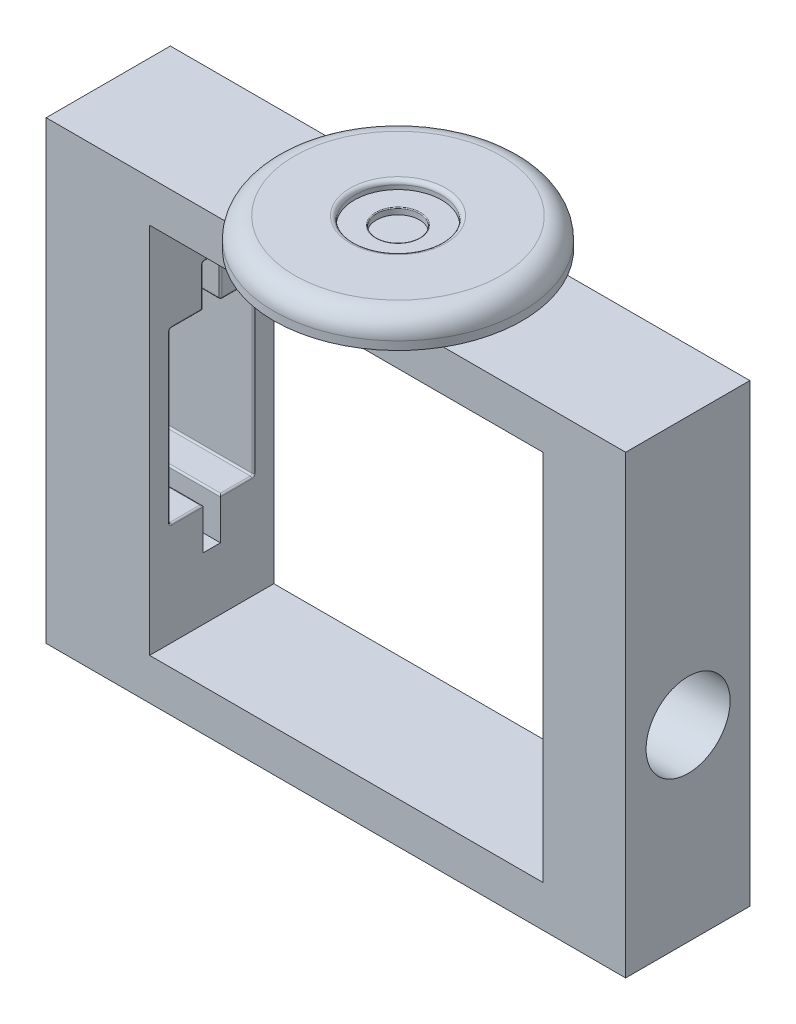
from build123d import *

# Parameters (mm, degrees)
FILLET1_R           = 1
SKETCH2_R           = 5.2
CUT_EXTRUDE1_DEPTH  = 1.5
FILLET2_R           = 0.2
FILLET3_R           = 5
CUT_EXTRUDE2_DEPTH  = 1
SKETCH14_W          = 140
SKETCH14_H          = 30
BOSS_EXTRUDE1_DEPTH = 10
SKETCH15_W          = 25
SKETCH15_H          = 30
SKETCH15_W_2        = 20
BOSS_EXTRUDE2_DEPTH = 90
SKETCH16_W          = 140
SKETCH16_H          = 30
BOSS_EXTRUDE3_DEPTH = 10
SKETCH17_W          = 20.2
SKETCH17_H          = 40.8
CUT_EXTRUDE3_DEPTH  = 25
SKETCH19_W          = 25
SKETCH19_H          = 4.2
CUT_EXTRUDE4_DEPTH  = 10
SKETCH21_W          = 25
SKETCH21_H          = 4.2
CUT_EXTRUDE6_DEPTH  = 10
FILLET4_R           = 0.4
SKETCH22_R          = 10.15
CUT_EXTRUDE7_DEPTH  = 22


with BuildPart() as part:
    # Sketch1 → Revolve1 (revolve)
    with BuildSketch(Plane(origin=(0, 0, 0), x_dir=(0, 0, -1), z_dir=(1, 0, 0))):
        Polygon((0, 0), (-30, 0), (-30, 7), (-20.102542457, 7), (-10.55, 7), (-10.55, 5), (0, 5), align=None)
    revolve(axis=Axis((0, 5, 0), (0, -1, 0)))

    # Fillet1
    fillet1_edges = [part.edges().sort_by_distance(p)[0] for p in [
        (0, 7, -10.55),
    ]]
    fillet(fillet1_edges, radius=FILLET1_R)

    # Sketch2 → Cut-Extrude1 (cut)
    with BuildSketch(Plane(origin=(0, 5, 0), x_dir=(1, 0, 0), z_dir=(0, 1, 0))):
        with Locations(Location((0, 0, 0), (0, 0, 270))):
            Circle(SKETCH2_R)
    extrude(amount=-CUT_EXTRUDE1_DEPTH, mode=Mode.SUBTRACT)

    # Fillet2
    fillet2_edges = [part.edges().sort_by_distance(p)[0] for p in [
        (0, 5, -5.2),
    ]]
    fillet(fillet2_edges, radius=FILLET2_R)

    # Fillet3
    fillet3_edges = [part.edges().sort_by_distance(p)[0] for p in [
        (0, 7, -30),
    ]]
    fillet(fillet3_edges, radius=FILLET3_R)

    # Sketch4 → Cut-Extrude2 (cut)
    # profile 1 of 4: a face of its own
    with BuildSketch(Plane.XZ):
        Polygon((-0.644909543, 25.480704332), (0.002225874, 25.480704332), (0.002225874, 21.980704332), (-0.31187669, 21.980704332), (-0.31187669, 25.121729973), (-0.850338229, 25.121729973), align=None)
    # profile 2 of 4: a face of its own
    with BuildSketch(Plane.XZ):
        with BuildLine():
            Line((25.523815675, 2.292498481), (25.209713111, 2.292498481))
            add(Edge.make_bspline(
                [(25.209713111, 2.292498481), (25.211760264, 2.334169369), (25.215780818, 2.416009884), (25.234609107, 2.53533379), (25.261549984, 2.649388589), (25.299641438, 2.757258503), (25.346947716, 2.85989731), (25.403677743, 2.956897326), (25.470871594, 3.047888515), (25.547078328, 3.132027358), (25.629846967, 3.209214929), (25.719152906, 3.275870171), (25.812997934, 3.332187843), (25.911097333, 3.379269085), (26.014557896, 3.414608931), (26.122440754, 3.44083057), (26.23521989, 3.456606916), (26.312059912, 3.458302702), (26.351139393, 3.459165148)],
                knots=[0, 0, 0, 0, 1.10065271, 2.161652631, 3.183658789, 4.190468796, 5.17591951, 6.163126047, 7.15150782, 8.156236427, 9.156009102, 10.134482811, 11.092018607, 12.041330605, 13.001268258, 13.972401359, 14.968799086, 16, 16, 16, 16], degree=3))
            add(Edge.make_bspline(
                [(26.351139393, 3.459165148), (26.389517467, 3.458266692), (26.464929011, 3.456501257), (26.574991026, 3.441340228), (26.67976832, 3.417594636), (26.779056087, 3.38427922), (26.872062151, 3.339494792), (26.959485196, 3.285697254), (27.042366007, 3.223477422), (27.11697279, 3.150223609), (27.18548087, 3.072021224), (27.244583125, 2.988533321), (27.295196288, 2.902304035), (27.337383968, 2.812675833), (27.368440107, 2.718804805), (27.392018315, 2.622057602), (27.405345729, 2.521432791), (27.407391152, 2.453326236), (27.408431059, 2.418700405)],
                knots=[0, 0, 0, 0, 1.111607364, 2.184268762, 3.212621178, 4.221274766, 5.211760367, 6.196651075, 7.1921475, 8.207485113, 9.220403448, 10.201281604, 11.166441695, 12.114753415, 13.065576456, 14.026450734, 14.996634279, 16, 16, 16, 16], degree=3))
            add(Edge.make_bspline(
                [(27.408431059, 2.418700405), (27.406744414, 2.369950595), (27.403400723, 2.273306467), (27.37454502, 2.13110211), (27.329962923, 1.99319705), (27.275889894, 1.882217998), (27.221269326, 1.793241105), (27.17308953, 1.719325464), (27.115437178, 1.640499047), (27.048839764, 1.555967938), (26.974301958, 1.465473568), (26.89128729, 1.368978802), (26.7991616, 1.267508497), (26.734503418, 1.198202684), (26.700999168, 1.162290148)],
                knots=[0, 0, 0, 0, 1.184203166, 2.347625244, 3.513805382, 4.700623107, 5.337941753, 6.051866363, 6.845199593, 7.711357327, 8.668078039, 9.695487809, 10.805859518, 12, 12, 12, 12], degree=3))
            Line((26.700999168, 1.162290148), (25.825298046, 0.228395917))
            Line((25.825298046, 0.228395917), (27.453302854, 0.228395917))
            Line((27.453302854, 0.228395917), (27.453302854, -0.130578442))
            Line((27.453302854, -0.130578442), (25.075097726, -0.130578442))
            Line((25.075097726, -0.130578442), (26.432469521, 1.317939187))
            add(Edge.make_bspline(
                [(26.432469521, 1.317939187), (26.465517408, 1.352437493), (26.528995635, 1.41870168), (26.618778212, 1.51544464), (26.6994172, 1.605194181), (26.771434593, 1.687780729), (26.833268098, 1.764412297), (26.88814033, 1.832607), (26.932105921, 1.895361451), (26.979821317, 1.968102065), (27.026035298, 2.056914382), (27.065747654, 2.165448071), (27.089962502, 2.277175324), (27.092867338, 2.352677361), (27.094328495, 2.390655533)],
                knots=[0, 0, 0, 0, 1.329631726, 2.553950428, 3.673215718, 4.687767853, 5.603093632, 6.413772471, 7.123043292, 7.734684054, 8.834405432, 9.900288307, 10.943827018, 12, 12, 12, 12], degree=3))
            add(Edge.make_bspline(
                [(27.094328495, 2.390655533), (27.093692753, 2.414536931), (27.092439827, 2.461602582), (27.081382129, 2.530608341), (27.064671623, 2.597173154), (27.040726365, 2.661501774), (27.009119625, 2.722947426), (26.970646245, 2.781584906), (26.926256182, 2.838273871), (26.874904912, 2.891427169), (26.818493393, 2.940108375), (26.758899143, 2.98323246), (26.695849039, 3.019271571), (26.629608917, 3.048815068), (26.560363447, 3.071990449), (26.487978702, 3.088049029), (26.412654686, 3.098131512), (26.36122119, 3.099495684), (26.335013591, 3.100190789)],
                knots=[0, 0, 0, 0, 0.991446411, 1.95395049, 2.89581595, 3.838931463, 4.798493298, 5.75982156, 6.748411868, 7.785213223, 8.824556874, 9.840280684, 10.836137867, 11.835679398, 12.848801643, 13.863922112, 14.911575587, 16, 16, 16, 16], degree=3))
            add(Edge.make_bspline(
                [(26.335013591, 3.100190789), (26.307642759, 3.099475757), (26.253890962, 3.098071552), (26.174971929, 3.088248888), (26.099686152, 3.071303047), (26.027844249, 3.048126373), (25.959324663, 3.018667824), (25.894460619, 2.981976079), (25.83339773, 2.938192586), (25.776021206, 2.88855203), (25.723157227, 2.833284429), (25.676710352, 2.771674466), (25.636126337, 2.70484705), (25.600717104, 2.6329825), (25.571961414, 2.55542872), (25.549988263, 2.472461015), (25.532601417, 2.384439633), (25.526792896, 2.323654549), (25.523815675, 2.292498481)],
                knots=[0, 0, 0, 0, 1.031018746, 2.02475058, 2.990194455, 3.934040569, 4.864654155, 5.795059489, 6.735614925, 7.690564532, 8.649604399, 9.611025574, 10.590972636, 11.591080095, 12.624614302, 13.701020113, 14.821632451, 16, 16, 16, 16], degree=3))
        make_face()
    # profile 3 of 4: a face of its own
    with BuildSketch(Plane.XZ):
        with BuildLine():
            Line((0.191598009, -25.382057247), (-0.122504556, -25.382057247))
            add(Edge.make_bspline(
                [(-0.122504556, -25.382057247), (-0.113995005, -25.346824763), (-0.097359529, -25.277948138), (-0.062661956, -25.179540878), (-0.024862701, -25.086417356), (0.020526404, -25.000321283), (0.070035158, -24.91952238), (0.12675788, -24.845853255), (0.188077602, -24.77744029), (0.255902552, -24.716727052), (0.327031213, -24.661749323), (0.402465833, -24.614874266), (0.480688727, -24.574550113), (0.56224186, -24.541329881), (0.647368031, -24.516304357), (0.735297655, -24.498147552), (0.826261155, -24.486356438), (0.888008745, -24.485205674), (0.919362432, -24.484621349)],
                knots=[0, 0, 0, 0, 1.162005537, 2.271625781, 3.343758855, 4.383309926, 5.390229558, 6.379919256, 7.361854164, 8.333198761, 9.295911338, 10.242430842, 11.177959212, 12.116337295, 13.062827104, 14.020064771, 14.994644689, 16, 16, 16, 16], degree=3))
            add(Edge.make_bspline(
                [(0.919362432, -24.484621349), (0.965045174, -24.48600058), (1.055414185, -24.488728955), (1.188177232, -24.513643392), (1.316204051, -24.553068524), (1.438093299, -24.607542251), (1.551311731, -24.674729564), (1.652047918, -24.754694301), (1.738936429, -24.845893603), (1.811830806, -24.946626167), (1.868905805, -25.054281676), (1.910992179, -25.165081833), (1.93661386, -25.278763805), (1.939934417, -25.355521084), (1.941598009, -25.393976317)],
                knots=[0, 0, 0, 0, 1.083050992, 2.142477498, 3.193116406, 4.255571735, 5.30263384, 6.308962982, 7.297363603, 8.282367274, 9.249857812, 10.179914175, 11.08814088, 12, 12, 12, 12], degree=3))
            add(Edge.make_bspline(
                [(1.941598009, -25.393976317), (1.940434418, -25.430983112), (1.93815745, -25.503399667), (1.918823745, -25.609121164), (1.886287482, -25.708762764), (1.841217719, -25.802743926), (1.782876169, -25.890468766), (1.712203472, -25.972134657), (1.628700811, -26.048103815), (1.565421872, -26.091623288), (1.532844002, -26.114028401)],
                knots=[0, 0, 0, 0, 1.024540389, 2.004866551, 2.965041327, 3.920577974, 4.882998113, 5.874504559, 6.905732034, 8, 8, 8, 8], degree=3))
            add(Edge.make_bspline(
                [(1.532844002, -26.114028401), (1.570075757, -26.132006572), (1.643842631, -26.16762653), (1.744393161, -26.237482287), (1.835671036, -26.318138635), (1.886574755, -26.381081288), (1.912150893, -26.412706285)],
                knots=[0, 0, 0, 0, 1.015518401, 2.012035669, 3.001164323, 4, 4, 4, 4], degree=3))
            add(Edge.make_bspline(
                [(1.912150893, -26.412706285), (1.928992236, -26.435764037), (1.962399132, -26.481501953), (2.003634665, -26.555038379), (2.04104378, -26.629389869), (2.070193999, -26.706549275), (2.092767866, -26.785622288), (2.108903898, -26.866744684), (2.118928039, -26.949982707), (2.120363591, -27.006295187), (2.121085188, -27.034601317)],
                knots=[0, 0, 0, 0, 1.025084078, 2.033381695, 3.024893161, 4.013698104, 4.991890475, 5.976764909, 6.982997093, 8, 8, 8, 8], degree=3))
            add(Edge.make_bspline(
                [(2.121085188, -27.034601317), (2.119290675, -27.083611039), (2.115710093, -27.18139984), (2.083706018, -27.325874562), (2.034092778, -27.467100064), (1.963635842, -27.602174904), (1.877768333, -27.728555285), (1.775611009, -27.841631594), (1.6583246, -27.938830198), (1.527518951, -28.020040426), (1.385801823, -28.084958348), (1.234226231, -28.130015791), (1.074976177, -28.159361791), (0.965768879, -28.16250866), (0.910247848, -28.164108529)],
                knots=[0, 0, 0, 0, 0.955779014, 1.907060117, 2.875433937, 3.871313158, 4.872415639, 5.851225146, 6.836215519, 7.83643374, 8.849228613, 9.86973379, 10.916971861, 12, 12, 12, 12], degree=3))
            add(Edge.make_bspline(
                [(0.910247848, -28.164108529), (0.872828548, -28.163240316), (0.799199843, -28.161531961), (0.690956345, -28.14985336), (0.587634645, -28.128523355), (0.489095047, -28.09982005), (0.395250011, -28.063428308), (0.306385906, -28.01810961), (0.221956012, -27.964798108), (0.142757061, -27.90286452), (0.068798493, -27.83358318), (0.002045769, -27.75572417), (-0.058614024, -27.670726766), (-0.111556662, -27.57760371), (-0.159193615, -27.477558453), (-0.198374572, -27.369309954), (-0.23286014, -27.253825932), (-0.248893605, -27.173348192), (-0.25711994, -27.132057247)],
                knots=[0, 0, 0, 0, 1.048658725, 2.063410685, 3.046034179, 4.001477787, 4.936774919, 5.862367409, 6.792675028, 7.730719943, 8.675894397, 9.627829632, 10.600096036, 11.597688215, 12.626045268, 13.701542398, 14.82072376, 16, 16, 16, 16], degree=3))
            Line((-0.25711994, -27.132057247), (0.056982624, -27.132057247))
            add(Edge.make_bspline(
                [(0.056982624, -27.132057247), (0.065165915, -27.15900626), (0.081083128, -27.211424432), (0.108177426, -27.286864737), (0.139045698, -27.356022791), (0.172160257, -27.419405913), (0.206938703, -27.477638315), (0.245853628, -27.529180184), (0.286022773, -27.576295386), (0.316302126, -27.602839998), (0.331121246, -27.615831285)],
                knots=[0, 0, 0, 0, 1.198163088, 2.33053128, 3.407730985, 4.417276592, 5.372219308, 6.28897303, 7.162600585, 8, 8, 8, 8], degree=3))
            add(Edge.make_bspline(
                [(0.331121246, -27.615831285), (0.350717822, -27.630939619), (0.389850485, -27.661109651), (0.453618716, -27.69961128), (0.520683602, -27.732972305), (0.592498277, -27.758456001), (0.667513047, -27.780033661), (0.746940412, -27.79415418), (0.830079629, -27.803842352), (0.886847393, -27.804697283), (0.915856823, -27.80513417)],
                knots=[0, 0, 0, 0, 0.946170439, 1.889420265, 2.845303464, 3.807233317, 4.801018734, 5.828864929, 6.890507805, 8, 8, 8, 8], degree=3))
            add(Edge.make_bspline(
                [(0.915856823, -27.80513417), (0.948610325, -27.804518265), (1.012656972, -27.803313915), (1.106111832, -27.792238208), (1.195019279, -27.776107795), (1.278392205, -27.751194812), (1.357322712, -27.720413961), (1.430704362, -27.681765555), (1.499500468, -27.636420833), (1.562829874, -27.584881675), (1.619775381, -27.52846018), (1.669914894, -27.469447109), (1.712539556, -27.408091279), (1.746923134, -27.344053158), (1.774073684, -27.277597929), (1.792556885, -27.2085391), (1.8054084, -27.137441834), (1.806455012, -27.089112865), (1.806982624, -27.064749555)],
                knots=[0, 0, 0, 0, 1.217147791, 2.380027433, 3.494444702, 4.572153297, 5.609568379, 6.639424714, 7.649109417, 8.668170816, 9.669597737, 10.625200337, 11.543417969, 12.441394052, 13.322311151, 14.205496177, 15.095365482, 16, 16, 16, 16], degree=3))
            add(Edge.make_bspline(
                [(1.806982624, -27.064749555), (1.805452322, -27.032138216), (1.802399334, -26.967077807), (1.779090755, -26.871360233), (1.74075189, -26.779136821), (1.687079379, -26.691981031), (1.62174365, -26.611205129), (1.545378744, -26.539133647), (1.457350515, -26.479663556), (1.376330646, -26.438574899), (1.30456549, -26.410537824), (1.243150105, -26.39186286), (1.174393502, -26.376049204), (1.099127153, -26.361336932), (1.016783936, -26.348815584), (0.927453498, -26.338373768), (0.831117737, -26.330018727), (0.764426571, -26.326287632), (0.730059547, -26.324364939)],
                knots=[0, 0, 0, 0, 1.07054697, 2.135767047, 3.216561865, 4.33974944, 5.486079747, 6.621378074, 7.775625952, 8.963672916, 9.598146892, 10.304877434, 11.070270905, 11.915000392, 12.823868403, 13.805723172, 14.86925407, 16, 16, 16, 16], degree=3))
            Line((0.730059547, -26.324364939), (0.730059547, -25.96539058))
            add(Edge.make_bspline(
                [(0.730059547, -25.96539058), (0.773360713, -25.964655776), (0.858177059, -25.963216476), (0.982071364, -25.945808466), (1.100544676, -25.921727838), (1.210971418, -25.884842646), (1.311620132, -25.842002349), (1.398939734, -25.792150139), (1.471706881, -25.73673539), (1.529567952, -25.674902781), (1.573097181, -25.608587733), (1.604923979, -25.539471076), (1.623724305, -25.466947015), (1.626233972, -25.417452347), (1.627495444, -25.392574074)],
                knots=[0, 0, 0, 0, 1.321986639, 2.589447074, 3.816329219, 5.01088745, 6.139805852, 7.153945165, 8.075214402, 8.924034688, 9.728124013, 10.488707548, 11.240355623, 12, 12, 12, 12], degree=3))
            add(Edge.make_bspline(
                [(1.627495444, -25.392574074), (1.627081034, -25.374296329), (1.626256583, -25.337933622), (1.615859305, -25.284808553), (1.600235264, -25.233307607), (1.578755535, -25.183649797), (1.550005336, -25.136179523), (1.515599349, -25.090492074), (1.474631249, -25.046848295), (1.427685802, -25.006167975), (1.377273997, -24.967398738), (1.322024222, -24.934485101), (1.263602347, -24.906340039), (1.201943692, -24.883130537), (1.136848162, -24.865671249), (1.068621604, -24.853135407), (0.997133921, -24.845297753), (0.948362189, -24.844169337), (0.923569162, -24.843595708)],
                knots=[0, 0, 0, 0, 0.884392785, 1.759457502, 2.611959086, 3.489218968, 4.37281399, 5.2945488, 6.255912374, 7.266815255, 8.301784654, 9.332968512, 10.37626691, 11.440494194, 12.520033166, 13.637162961, 14.798855837, 16, 16, 16, 16], degree=3))
            add(Edge.make_bspline(
                [(0.923569162, -24.843595708), (0.883717494, -24.84498707), (0.805877918, -24.847704724), (0.693663001, -24.871507737), (0.589343667, -24.909485821), (0.509605001, -24.95481884), (0.450722426, -24.999569274), (0.408645488, -25.038651661), (0.367324978, -25.082084484), (0.329479301, -25.13254286), (0.291205324, -25.18660965), (0.256360763, -25.247033331), (0.22250107, -25.312237726), (0.202098521, -25.35833336), (0.191598009, -25.382057247)],
                knots=[0, 0, 0, 0, 1.472543308, 2.876219568, 4.221790263, 5.565193594, 6.249813518, 6.953379497, 7.687249741, 8.463570142, 9.283606569, 10.136032583, 11.040678096, 12, 12, 12, 12], degree=3))
        make_face()
    # profile 4 of 4: a face of its own
    with BuildSketch(Plane.XZ):
        Polygon((-24.810460542, 5.722524802), (-24.746658459, 5.722524802), (-24.746658459, 3.299447879), (-24.342812305, 3.299447879), (-24.342812305, 2.94047352), (-24.746658459, 2.94047352), (-24.746658459, 2.132781212), (-25.060761023, 2.132781212), (-25.060761023, 2.94047352), (-26.721017433, 2.94047352), align=None)
        Polygon((-25.060761023, 3.299447879), (-25.060761023, 4.818077687), (-26.103329132, 3.299447879), align=None, mode=Mode.SUBTRACT)
    extrude(amount=-CUT_EXTRUDE2_DEPTH, mode=Mode.SUBTRACT)

    # Sketch14 → Boss-Extrude1 (add)
    with BuildSketch(Plane.XZ):
        Rectangle(SKETCH14_W, SKETCH14_H)
    extrude(amount=BOSS_EXTRUDE1_DEPTH)

    # Sketch15 → Boss-Extrude2 (add)
    with BuildSketch(Plane.XZ.offset(10)):
        with Locations((-57.5, 0)):
            Rectangle(SKETCH15_W, SKETCH15_H)
        with Locations((60, 0)):
            Rectangle(SKETCH15_W_2, SKETCH15_H)
    extrude(amount=BOSS_EXTRUDE2_DEPTH)

    # Sketch16 → Boss-Extrude3 (add)
    with BuildSketch(Plane.XZ.offset(100)):
        Rectangle(SKETCH16_W, SKETCH16_H)
    extrude(amount=BOSS_EXTRUDE3_DEPTH)

    # Sketch17 → Cut-Extrude3 (cut)
    with BuildSketch(Plane(origin=(-45, 0, 0), x_dir=(0, 0, -1), z_dir=(1, 0, 0))):
        with Locations((0, -54.6)):
            Rectangle(SKETCH17_W, SKETCH17_H)
    extrude(amount=-CUT_EXTRUDE3_DEPTH, mode=Mode.SUBTRACT)

    # Sketch19 → Cut-Extrude4 (cut)
    with BuildSketch(Plane.XZ.offset(34.2)):
        with Locations((-57.5, 0)):
            Rectangle(SKETCH19_W, SKETCH19_H)
    extrude(amount=-CUT_EXTRUDE4_DEPTH, mode=Mode.SUBTRACT)

    # Sketch21 → Cut-Extrude6 (cut)
    with BuildSketch(Plane(origin=(0, -75, 0), x_dir=(1, 0, 0), z_dir=(0, 1, 0))):
        with Locations((-57.5, 0)):
            Rectangle(SKETCH21_W, SKETCH21_H)
    extrude(amount=-CUT_EXTRUDE6_DEPTH, mode=Mode.SUBTRACT)

    # Fillet4
    fillet4_edges = [part.edges().sort_by_distance(p)[0] for p in [
        (-70, -75, -6.1),
        (-45, -75, -6.1),
        (-70, -34.2, -6.1),
        (-45, -34.2, -6.1),
        (-70, -24.2, 0),
        (-45, -24.2, 0),
        (-70, -34.2, 6.1),
        (-45, -34.2, 6.1),
        (-70, -75, 6.1),
        (-45, -75, 6.1),
        (-57.5, -75, -10.1),
        (-70, -54.6, -10.1),
        (-57.5, -34.2, -10.1),
        (-45, -54.6, -10.1),
        (-45, -29.2, 2.1),
        (-57.5, -24.2, 2.1),
        (-70, -29.2, 2.1),
        (-57.5, -34.2, 2.1),
        (-70, -29.2, -2.1),
        (-57.5, -24.2, -2.1),
        (-45, -29.2, -2.1),
        (-57.5, -34.2, -2.1),
        (-57.5, -34.2, 10.1),
        (-70, -54.6, 10.1),
        (-57.5, -75, 10.1),
        (-45, -54.6, 10.1),
        (-57.5, -75, 2.1),
        (-57.5, -75, -2.1),
    ]]
    fillet(fillet4_edges, radius=FILLET4_R)

    # Sketch22 → Cut-Extrude7 (cut)
    with BuildSketch(Plane(origin=(70, 0, 0), x_dir=(0, 0, -1), z_dir=(1, 0, 0))):
        with Locations((0.08865233, -64.60277887)):
            Circle(SKETCH22_R)
    extrude(amount=-CUT_EXTRUDE7_DEPTH, mode=Mode.SUBTRACT)


solid = part.part
